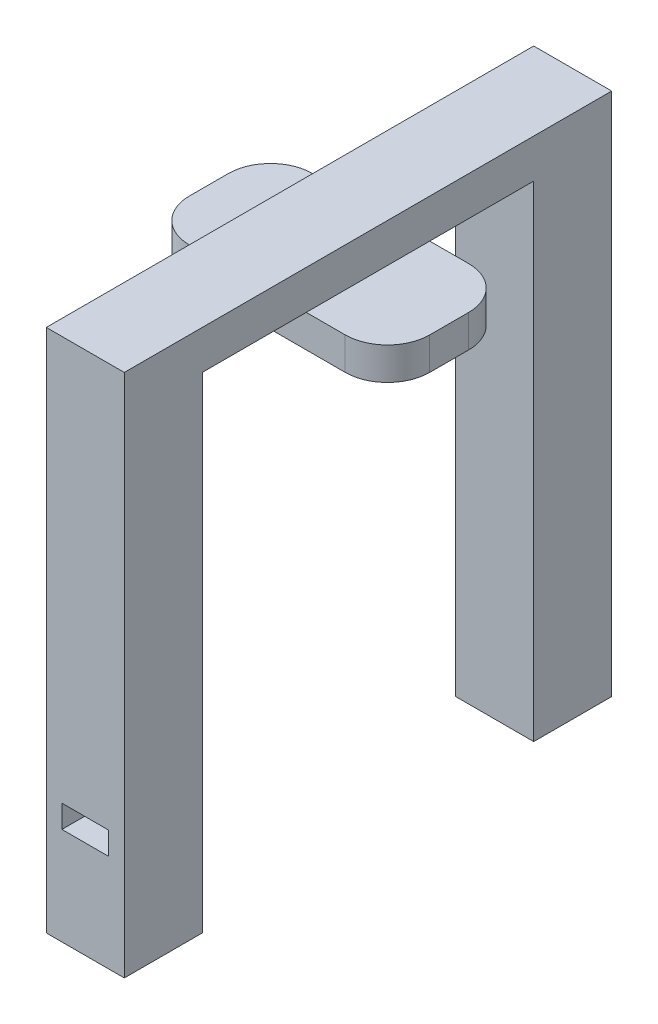
from build123d import *

# Parameters (mm, degrees)
ESQUISSE1_W             = 37
ESQUISSE1_H             = 19
BOSS_EXTRU_1_DEPTH      = 5
CONG_1_R                = 6.5
ESQUISSE4_W             = 12
ESQUISSE4_H             = 75
BOSS_EXTRU_2_DEPTH      = 6
ESQUISSE5_W             = 12
ESQUISSE5_H             = 12
BOSS_EXTRU_3_DEPTH      = 74.7
ESQUISSE6_R             = 2.075
ENL_V_MAT_EXTRU_1_DEPTH = 40
ESQUISSE7_W             = 7.2
ESQUISSE7_H             = 3.5
ENL_V_MAT_EXTRU_2_DEPTH = 10.25
ESQUISSE8_W             = 7.2
ESQUISSE8_H             = 3.5
ENL_V_MAT_EXTRU_3_DEPTH = 10.25


with BuildPart() as part:
    # Esquisse1 → Boss.-Extru.1 (new body)
    with BuildSketch(Plane(origin=(0, 0, 0), x_dir=(1, 0, 0), z_dir=(0, 1, 0))):
        with Locations((-4.867406947, 1.932441033)):
            Rectangle(ESQUISSE1_W, ESQUISSE1_H)
    extrude(amount=BOSS_EXTRU_1_DEPTH)

    # Congé1
    cong_1_edges = [part.edges().sort_by_distance(p)[0] for p in [
        (-23.367406947, 2.5, -11.432441033),
        (13.632593053, 2.5, -11.432441033),
        (13.632593053, 2.5, 7.567558967),
        (-23.367406947, 2.5, 7.567558967),
    ]]
    fillet(cong_1_edges, radius=CONG_1_R)

    # Esquisse4 → Boss.-Extru.2 (add)
    with BuildSketch(Plane(origin=(0, 5, 0), x_dir=(1, 0, 0), z_dir=(0, 1, 0))):
        with Locations((-4.867406947, 1.932441033)):
            Rectangle(ESQUISSE4_W, ESQUISSE4_H)
    extrude(amount=BOSS_EXTRU_2_DEPTH)

    # Esquisse5 → Boss.-Extru.3 (add)
    with BuildSketch(Plane(origin=(0, 5, 0), x_dir=(-1, 0, 0), z_dir=(0, -1, 0))):
        with Locations((4.867406947, 33.432441033)):
            Rectangle(ESQUISSE5_W, ESQUISSE5_H)
        with Locations((4.867406947, -29.567558967)):
            Rectangle(ESQUISSE5_W, ESQUISSE5_H)
    extrude(amount=BOSS_EXTRU_3_DEPTH)

    # Esquisse6 → Enlèv. mat.-Extru.1 (cut)
    with BuildSketch(Plane.XZ.offset(69.7)):
        with Locations(Location((-4.867406947, 29.567558967, 0), (0, 0, 270))):
            Circle(ESQUISSE6_R)
        with Locations(Location((-4.867406947, -33.432441033, 0), (0, 0, 270))):
            Circle(ESQUISSE6_R)
    extrude(amount=-ENL_V_MAT_EXTRU_1_DEPTH, mode=Mode.SUBTRACT)

    # Esquisse7 → Enlèv. mat.-Extru.2 (cut)
    with BuildSketch(Plane.XY.offset(35.567558967)):
        with Locations((-4.867406947, -52.95)):
            Rectangle(ESQUISSE7_W, ESQUISSE7_H)
    extrude(amount=-ENL_V_MAT_EXTRU_2_DEPTH, mode=Mode.SUBTRACT)

    # Esquisse8 → Enlèv. mat.-Extru.3 (cut)
    with BuildSketch(Plane(origin=(0, 0, -39.432441033), x_dir=(-1, 0, 0), z_dir=(0, 0, -1))):
        with Locations((4.867406947, -52.95)):
            Rectangle(ESQUISSE8_W, ESQUISSE8_H)
    extrude(amount=-ENL_V_MAT_EXTRU_3_DEPTH, mode=Mode.SUBTRACT)


solid = part.part
